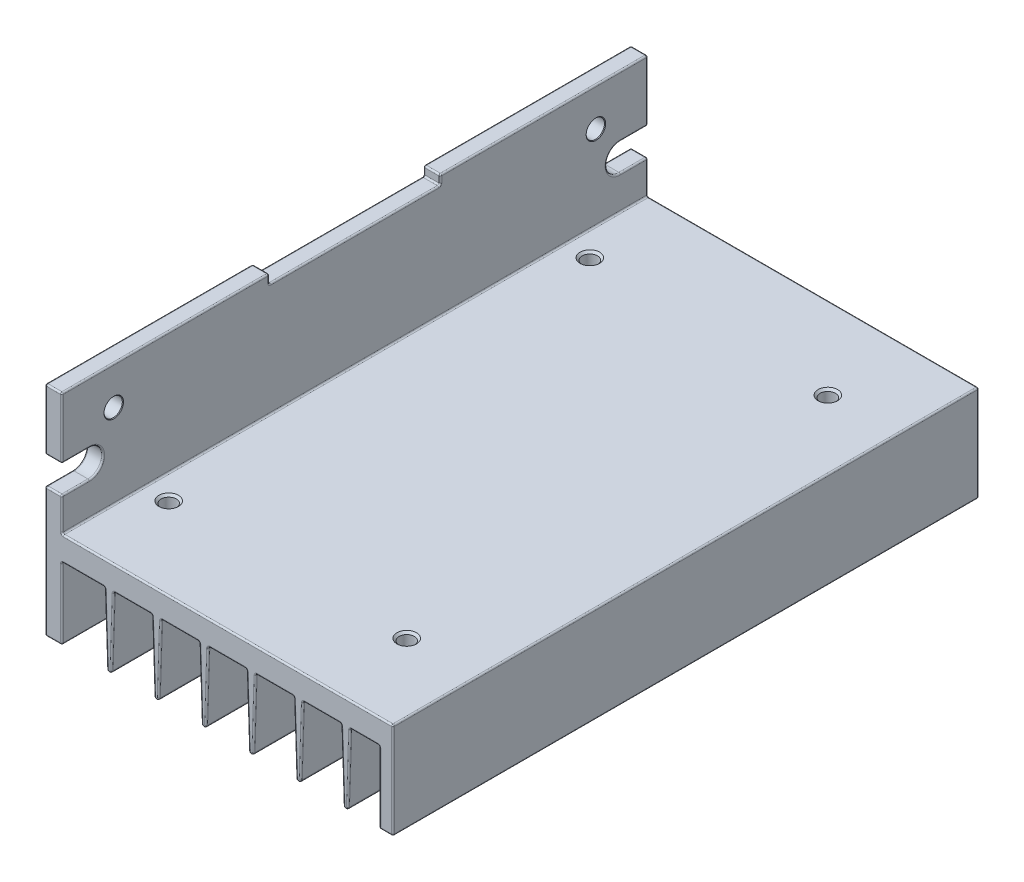
from build123d import *

# Parameters (mm, degrees)
BODY_DEPTH                  = 48
TOP_CUT_OUT_SKETCH_W        = 28
TOP_CUT_OUT_SKETCH_H        = 28
TOP_CUT_OUT_DEPTH           = 1.5
SIDE_CUT_OUT_DEPTH          = 76.146939392
M3_TOP_HOLES_AT_2_COUNT     = 2
M3_TOP_HOLES_AT_2_PITCH     = 69
M3_TOP_HOLES_AT_3_COUNT     = 2
M3_TOP_HOLES_AT_3_PITCH     = 79.259068882
M3_TOP_HOLES_AT_4_COUNT     = 2
M3_TOP_HOLES_AT_4_PITCH     = 39
F_3_0_SIDE_HOLES_AT_2_COUNT = 2
F_3_0_SIDE_HOLES_AT_2_PITCH = 79
PRODUCTION_FILLET_R         = 0.25


with BuildPart() as part:
    # Body Profile Sketch → Body (new, symmetric)
    with BuildSketch(Plane.XY):
        with BuildLine():
            Line((0.25, 0), (54, 0))
            ThreePointArc((54, 0), (54.176776695, -0.073223305), (54.25, -0.25))
            Line((54.25, -0.25), (54.25, -15.5))
            ThreePointArc((54.25, -15.5), (54.176776695, -15.676776695), (54, -15.75))
            Line((54, -15.75), (52.25, -15.75))
            ThreePointArc((52.25, -15.75), (52.073223305, -15.676776695), (52, -15.5))
            Line((52, -15.5), (52, -4.25))
            ThreePointArc((52, -4.25), (51.926776695, -4.073223305), (51.75, -4))
            Line((51.75, -4), (47.491898383, -4))
            ThreePointArc((47.491898383, -4), (47.318056795, -4.070336141), (47.242033979, -4.241767182))
            Line((47.242033979, -4.241767182), (46.874796607, -15.387349227))
            ThreePointArc((46.874796607, -15.387349227), (46.5, -15.75), (46.125203393, -15.387349227))
            Line((46.125203393, -15.387349227), (45.757966021, -4.241767182))
            ThreePointArc((45.757966021, -4.241767182), (45.681943205, -4.070336141), (45.508101617, -4))
            Line((45.508101617, -4), (39.741898383, -4))
            ThreePointArc((39.741898383, -4), (39.568056795, -4.070336141), (39.492033979, -4.241767182))
            Line((39.492033979, -4.241767182), (39.124796607, -15.387349227))
            ThreePointArc((39.124796607, -15.387349227), (38.75, -15.75), (38.375203393, -15.387349227))
            Line((38.375203393, -15.387349227), (38.007966021, -4.241767182))
            ThreePointArc((38.007966021, -4.241767182), (37.931943205, -4.070336141), (37.758101617, -4))
            Line((37.758101617, -4), (31.991898383, -4))
            ThreePointArc((31.991898383, -4), (31.818056795, -4.070336141), (31.742033979, -4.241767182))
            Line((31.742033979, -4.241767182), (31.374796607, -15.387349227))
            ThreePointArc((31.374796607, -15.387349227), (31, -15.75), (30.625203393, -15.387349227))
            Line((30.625203393, -15.387349227), (30.257966021, -4.241767182))
            ThreePointArc((30.257966021, -4.241767182), (30.181943205, -4.070336141), (30.008101617, -4))
            Line((30.008101617, -4), (24.241898383, -4))
            ThreePointArc((24.241898383, -4), (24.068056795, -4.070336141), (23.992033979, -4.241767182))
            Line((23.992033979, -4.241767182), (23.624796607, -15.387349227))
            ThreePointArc((23.624796607, -15.387349227), (23.25, -15.75), (22.875203393, -15.387349227))
            Line((22.875203393, -15.387349227), (22.507966021, -4.241767182))
            ThreePointArc((22.507966021, -4.241767182), (22.431943205, -4.070336141), (22.258101617, -4))
            Line((22.258101617, -4), (16.491898383, -4))
            ThreePointArc((16.491898383, -4), (16.318056795, -4.070336141), (16.242033979, -4.241767182))
            Line((16.242033979, -4.241767182), (15.874796607, -15.387349227))
            ThreePointArc((15.874796607, -15.387349227), (15.5, -15.75), (15.125203393, -15.387349227))
            Line((15.125203393, -15.387349227), (14.757966021, -4.241767182))
            ThreePointArc((14.757966021, -4.241767182), (14.681943205, -4.070336141), (14.508101617, -4))
            Line((14.508101617, -4), (8.741898383, -4))
            ThreePointArc((8.741898383, -4), (8.568056795, -4.070336141), (8.492033979, -4.241767182))
            Line((8.492033979, -4.241767182), (8.124796607, -15.387349227))
            ThreePointArc((8.124796607, -15.387349227), (7.75, -15.75), (7.375203393, -15.387349227))
            Line((7.375203393, -15.387349227), (7.007966021, -4.241767182))
            ThreePointArc((7.007966021, -4.241767182), (6.931943205, -4.070336141), (6.758101617, -4))
            Line((6.758101617, -4), (0.25, -4))
            ThreePointArc((0.25, -4), (0.073223305, -4.073223305), (0, -4.25))
            Line((0, -4.25), (0, -15.5))
            ThreePointArc((0, -15.5), (-0.073223305, -15.676776695), (-0.25, -15.75))
            Line((-0.25, -15.75), (-2.5, -15.75))
            ThreePointArc((-2.5, -15.75), (-2.676776695, -15.676776695), (-2.75, -15.5))
            Line((-2.75, -15.5), (-2.75, 19.75))
            ThreePointArc((-2.75, 19.75), (-2.676776695, 19.926776695), (-2.5, 20))
            Line((-2.5, 20), (-0.25, 20))
            ThreePointArc((-0.25, 20), (-0.073223305, 19.926776695), (0, 19.75))
            Line((0, 19.75), (0, 0.25))
            ThreePointArc((0, 0.25), (0.073223305, 0.073223305), (0.25, 0))
        make_face()
    extrude(amount=BODY_DEPTH, both=True)

    # Top Cut Out Sketch → Top Cut Out (cut)
    with BuildSketch(Plane(origin=(0, 20, 0), x_dir=(1, 0, 0), z_dir=(0, 1, 0))):
        Rectangle(TOP_CUT_OUT_SKETCH_W, TOP_CUT_OUT_SKETCH_H)
    extrude(amount=-TOP_CUT_OUT_DEPTH, mode=Mode.SUBTRACT)

    # Side Cut Out Sketch → Side Cut Out (cut, through all)
    with BuildSketch(Plane(origin=(0, 0, 0), x_dir=(0, 0, -1), z_dir=(1, 0, 0))):
        with BuildLine():
            Line((48, 10), (43.5, 10))
            ThreePointArc((43.5, 10), (41.25, 7.75), (43.5, 5.5))
            Line((43.5, 5.5), (48, 5.5))
            Line((48, 5.5), (48, 10))
        make_face()
        with BuildLine():
            Line((-48, 10), (-43.5, 10))
            ThreePointArc((-43.5, 10), (-41.25, 7.75), (-43.5, 5.5))
            Line((-43.5, 5.5), (-48, 5.5))
            Line((-48, 5.5), (-48, 10))
        make_face()
    extrude(amount=-SIDE_CUT_OUT_DEPTH, mode=Mode.SUBTRACT)

    # Sketch4 → M3 Top Holes (revolve, cut)
    with BuildSketch(Plane(origin=(43, 0, -34.5), x_dir=(0, 0, 1), z_dir=(1, 0, 0))):
        Polygon((0, 0), (0, 4), (1.6, 4), (1.25, 3.65), (1.25, 0.35), (1.6, 0), align=None)
    m3_top_holes = revolve(axis=Axis((43, 6.35, -34.5), (0, -1, 0)), mode=Mode.SUBTRACT)

    # M3 Top Holes at 2: M3 Top Holes ×2
    with Locations(*[(0, 0, i * M3_TOP_HOLES_AT_2_PITCH) for i in range(1, M3_TOP_HOLES_AT_2_COUNT)]):
        add(m3_top_holes, mode=Mode.SUBTRACT)

    # M3 Top Holes at 3: M3 Top Holes ×2
    with Locations(*[Vector(-0.4920572566679018, 0, 0.8705628387201343) * (i * M3_TOP_HOLES_AT_3_PITCH) for i in range(1, M3_TOP_HOLES_AT_3_COUNT)]):
        add(m3_top_holes, mode=Mode.SUBTRACT)

    # M3 Top Holes at 4: M3 Top Holes ×2
    with Locations(*[(-i * M3_TOP_HOLES_AT_4_PITCH, 0, 0) for i in range(1, M3_TOP_HOLES_AT_4_COUNT)]):
        add(m3_top_holes, mode=Mode.SUBTRACT)

    # Sketch6 → Ø3.0 Side Holes (revolve, cut)
    with BuildSketch(Plane(origin=(0, 13.75, -39.5), x_dir=(0, 0, -1), z_dir=(0, 1, 0))):
        Polygon((0, 0), (0, 2.75), (1.6, 2.75), (1.5, 2.65), (1.5, 0.1), (1.6, 0), align=None)
    f_3_0_side_holes = revolve(axis=Axis((6.35, 13.75, -39.5), (-1, 0, 0)), mode=Mode.SUBTRACT)

    # Ø3.0 Side Holes at 2: Ø3.0 Side Holes ×2
    with Locations(*[(0, 0, i * F_3_0_SIDE_HOLES_AT_2_PITCH) for i in range(1, F_3_0_SIDE_HOLES_AT_2_COUNT)]):
        add(f_3_0_side_holes, mode=Mode.SUBTRACT)

    # Production Fillet
    production_fillet_edges = [part.edges().sort_by_distance(p)[0] for p in [
        (-2.676776695, 19.926776695, 48),
        (31.818056795, -4.070336141, 48),
        (34.875, -4, 48),
        (37.931943205, -4.070336141, 48),
        (38.191584707, -9.814558204, 48),
        (38.75, -15.75, 48),
        (39.308415293, -9.814558204, 48),
        (39.568056795, -4.070336141, 48),
        (42.625, -4, 48),
        (45.681943205, -4.070336141, 48),
        (45.941584707, -9.814558204, 48),
        (-2.75, 14.875, 48),
        (46.5, -15.75, 48),
        (47.058415293, -9.814558204, 48),
        (47.318056795, -4.070336141, 48),
        (49.620949192, -4, 48),
        (51.926776695, -4.073223305, 48),
        (0, 18.5, 0),
        (0, 19.125, 14),
        (0, 19.125, -14),
        (52, -9.875, 48),
        (52.073223305, -15.676776695, 48),
        (-1.375, 20, 14),
        (53.125, -15.75, 48),
        (-1.375, 20, -14),
        (-2.75, 19.125, -14),
        (-2.676776695, 19.926776695, -14),
        (-0.073223305, 19.926776695, -14),
        (-1.375, 18.5, -14),
        (-2.676776695, 19.926776695, 14),
        (-2.75, 19.125, 14),
        (-1.375, 18.5, 14),
        (54.176776695, -15.676776695, 48),
        (-0.073223305, 19.926776695, 14),
        (-2.75, 18.5, 0),
        (54.25, -7.875, 48),
        (-2.676776695, -15.676776695, 48),
        (54.176776695, -0.073223305, 48),
        (27.125, 0, 48),
        (0.073223305, 0.073223305, 48),
        (0, 2.875, 48),
        (0, 14.875, -48),
        (-2.75, -5, -48),
        (-2.75, -5, 48),
        (0, 14.875, 48),
        (-1.375, 10, -48),
        (-2.75, 5.5, -45.75),
        (-1.375, 5.5, -48),
        (-2.75, 7.75, -41.25),
        (-1.375, -15.75, 48),
        (-2.75, 10, -45.75),
        (0, 10, -45.75),
        (0, 7.75, -41.25),
        (0, 5.5, -45.75),
        (-2.75, 7.75, 41.25),
        (-2.75, 5.5, 45.75),
        (-1.375, 5.5, 48),
        (-2.75, 10, 45.75),
        (-1.375, 10, 48),
        (0, 7.75, 41.25),
        (0, 10, 45.75),
        (0, 5.5, 45.75),
        (-0.073223305, -15.676776695, 48),
        (0, -9.875, 48),
        (0.073223305, -4.073223305, 48),
        (3.504050808, -4, 48),
        (6.931943205, -4.070336141, 48),
        (7.191584707, -9.814558204, 48),
        (-0.073223305, 19.926776695, 48),
        (7.75, -15.75, 48),
        (8.308415293, -9.814558204, 48),
        (8.568056795, -4.070336141, 48),
        (0, 2.875, -48),
        (0.073223305, 0.073223305, -48),
        (27.125, 0, -48),
        (54.176776695, -0.073223305, -48),
        (54.25, -7.875, -48),
        (54.176776695, -15.676776695, -48),
        (53.125, -15.75, -48),
        (52.073223305, -15.676776695, -48),
        (11.625, -4, 48),
        (52, -9.875, -48),
        (51.926776695, -4.073223305, -48),
        (49.620949192, -4, -48),
        (47.318056795, -4.070336141, -48),
        (47.058415293, -9.814558204, -48),
        (46.5, -15.75, -48),
        (45.941584707, -9.814558204, -48),
        (14.681943205, -4.070336141, 48),
        (45.681943205, -4.070336141, -48),
        (42.625, -4, -48),
        (39.568056795, -4.070336141, -48),
        (39.308415293, -9.814558204, -48),
        (38.75, -15.75, -48),
        (38.191584707, -9.814558204, -48),
        (37.931943205, -4.070336141, -48),
        (34.875, -4, -48),
        (14.941584707, -9.814558204, 48),
        (31.818056795, -4.070336141, -48),
        (31.558415293, -9.814558204, -48),
        (31, -15.75, -48),
        (30.441584707, -9.814558204, -48),
        (30.181943205, -4.070336141, -48),
        (27.125, -4, -48),
        (24.068056795, -4.070336141, -48),
        (15.5, -15.75, 48),
        (23.808415293, -9.814558204, -48),
        (23.25, -15.75, -48),
        (22.691584707, -9.814558204, -48),
        (22.431943205, -4.070336141, -48),
        (19.375, -4, -48),
        (16.318056795, -4.070336141, -48),
        (16.058415293, -9.814558204, -48),
        (15.5, -15.75, -48),
        (16.058415293, -9.814558204, 48),
        (14.941584707, -9.814558204, -48),
        (14.681943205, -4.070336141, -48),
        (11.625, -4, -48),
        (8.568056795, -4.070336141, -48),
        (8.308415293, -9.814558204, -48),
        (7.75, -15.75, -48),
        (7.191584707, -9.814558204, -48),
        (16.318056795, -4.070336141, 48),
        (6.931943205, -4.070336141, -48),
        (3.504050808, -4, -48),
        (0.073223305, -4.073223305, -48),
        (0, -9.875, -48),
        (-0.073223305, -15.676776695, -48),
        (-1.375, -15.75, -48),
        (-2.676776695, -15.676776695, -48),
        (-2.75, 14.875, -48),
        (19.375, -4, 48),
        (-2.676776695, 19.926776695, -48),
        (-1.375, 20, -48),
        (-0.073223305, 19.926776695, -48),
        (-1.375, 20, 48),
        (22.431943205, -4.070336141, 48),
        (22.691584707, -9.814558204, 48),
        (23.25, -15.75, 48),
        (23.808415293, -9.814558204, 48),
        (24.068056795, -4.070336141, 48),
        (27.125, -4, 48),
        (30.181943205, -4.070336141, 48),
        (30.441584707, -9.814558204, 48),
        (31, -15.75, 48),
        (31.558415293, -9.814558204, 48),
    ]]
    fillet(production_fillet_edges, radius=PRODUCTION_FILLET_R)


solid = part.part
